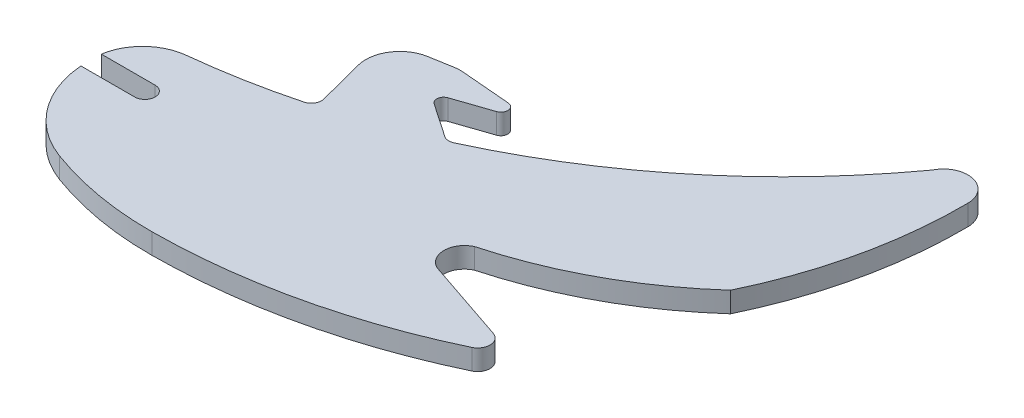
from build123d import *

# Parameters (mm, degrees)
BOSS_EXTRUDE1_DEPTH = 3
FILLET1_R           = 5
FILLET2_R           = 1
FILLET3_R           = 1.5


with BuildPart() as part:
    # Sketch1 → Boss-Extrude1 (new body)
    with BuildSketch(Plane(origin=(0, 0, 0), x_dir=(1, 0, 0), z_dir=(0, 1, 0))):
        with BuildLine():
            Line((0, 0), (7.87, 0))
            ThreePointArc((7.87, 0), (9.37, 1.5), (7.87, 3))
            Line((7.87, 3), (0, 3))
            ThreePointArc((0, 3), (2.150197581, 7.11318488), (6.36, 9.067463032))
            ThreePointArc((6.36, 9.067463032), (14.423757749, 10.275919643), (22.36, 12.146912791))
            Line((22.36, 12.146912791), (18.83, 25.66))
            Line((18.83, 25.66), (28.106454985, 27.26))
            Line((28.106454985, 27.26), (40.743591673, 26.19))
            Line((40.743591673, 26.19), (29.01, 22.19))
            Line((29.01, 22.19), (36.3, 17.207480276))
            ThreePointArc((36.3, 17.207480276), (57.98254967, 30.597458725), (75.506260733, 49.1))
            ThreePointArc((75.506260733, 49.1), (79.528190594, 51.04), (82.336251949, 47.568068084))
            ThreePointArc((82.336251949, 47.568068084), (80.805010077, 32.984321852), (76, 19.13))
            ThreePointArc((76, 19.13), (64.626879168, 11.098692866), (51.706470787, 5.910936222))
            ThreePointArc((51.706470787, 5.910936222), (49.97, 3.19), (51.706470787, 0.469063778))
            Line((51.706470787, 0.469063778), (64.104871289, -3.720532265))
            ThreePointArc((64.104871289, -3.720532265), (65.332594701, -5.328564668), (64.303533653, -7.070433303))
            ThreePointArc((64.303533653, -7.070433303), (45.731782679, -13.536259881), (26.199767539, -15.820385992))
            ThreePointArc((26.199767539, -15.820385992), (17.868444589, -15.127380639), (9.796210687, -12.952469527))
            ThreePointArc((9.796210687, -12.952469527), (3.000778454, -7.91122088), (0, 0))
        make_face()
    extrude(amount=BOSS_EXTRUDE1_DEPTH)

    # Fillet1
    fillet1_edges = [part.edges().sort_by_distance(p)[0] for p in [
        (18.83, 1.5, -25.66),
        (28.106454985, 1.5, -27.26),
    ]]
    fillet(fillet1_edges, radius=FILLET1_R)

    # Fillet2
    fillet2_edges = [part.edges().sort_by_distance(p)[0] for p in [
        (40.743591673, 1.5, -26.19),
        (29.01, 1.5, -22.19),
    ]]
    fillet(fillet2_edges, radius=FILLET2_R)

    # Fillet3
    fillet3_edges = [part.edges().sort_by_distance(p)[0] for p in [
        (22.36, 1.5, -12.146912791),
        (36.3, 1.5, -17.207480276),
    ]]
    fillet(fillet3_edges, radius=FILLET3_R)


solid = part.part
